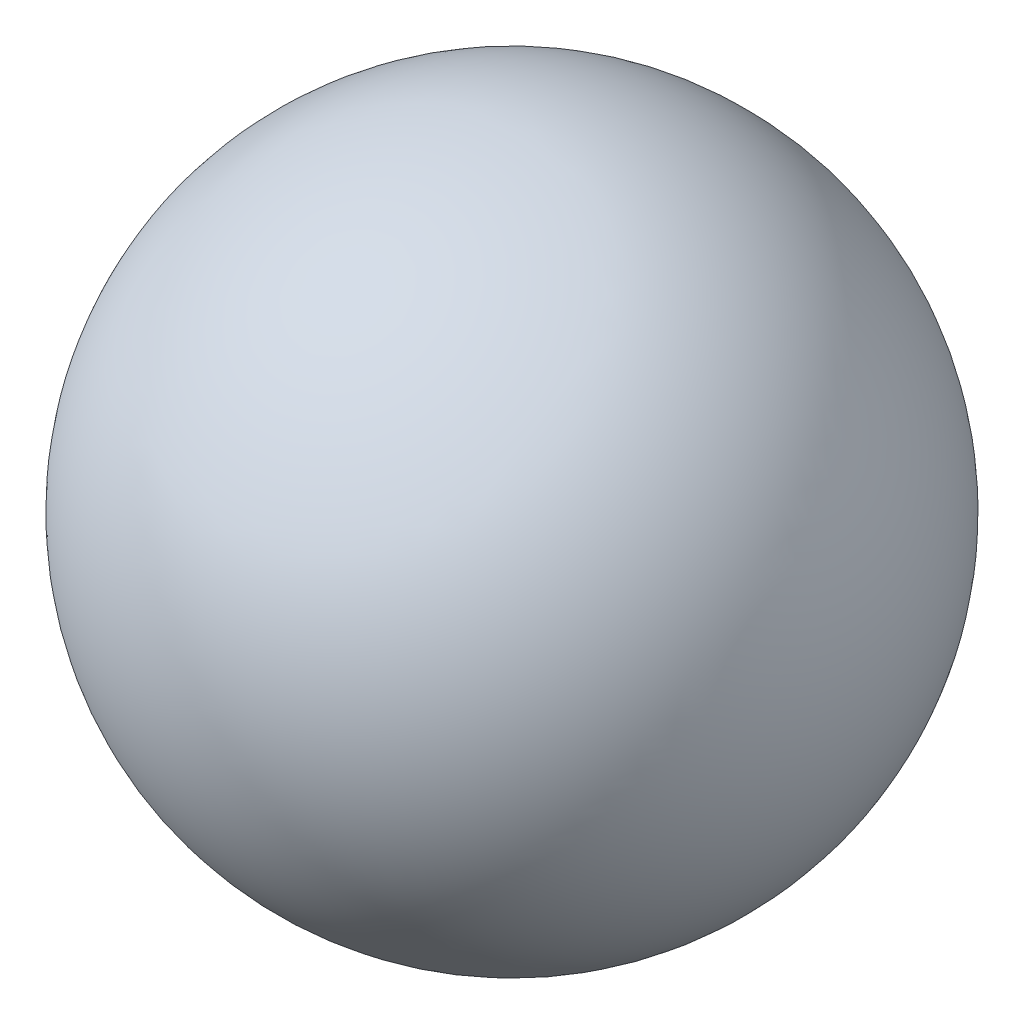
from build123d import *


with BuildPart() as part:
    # Sketch1 → Revolve1 (revolve)
    with BuildSketch(Plane.XY):
        with BuildLine():
            Line((-8, 0), (8, 0))
            ThreePointArc((8, 0), (0, 8), (-8, 0))
        make_face()
    revolve(axis=Axis((-8, 0, 0), (1, 0, 0)))


solid = part.part
